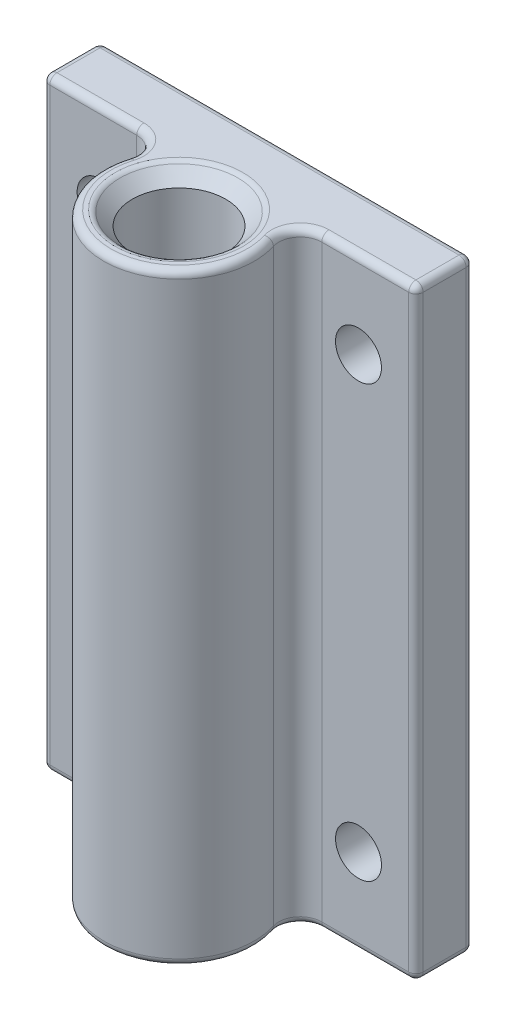
from build123d import *

# Parameters (mm, degrees)
SKETCH_1_W      = 26
SKETCH_1_H      = 42
SKETCH_1_R      = 1.6
EXTRUDE_1_DEPTH = 4
SKETCH_3_R      = 5.25
SKETCH_3_R_2    = 3.25
EXTRUDE_2_DEPTH = 21
FILLET_1_R      = 1.5
CHAMFER_1_SIZE  = 1
FILLET_3_R      = 0.5


with BuildPart() as part:
    # 草图1 → 凸台-拉伸1 (new body)
    with BuildSketch(Plane.XY):
        Rectangle(SKETCH_1_W, SKETCH_1_H)
        with Locations((-9, 15)):
            Circle(SKETCH_1_R, mode=Mode.SUBTRACT)
        with Locations(Location((-9, -15, 0), (0, 0, 180))):
            Circle(SKETCH_1_R, mode=Mode.SUBTRACT)
        with Locations((9, -15)):
            Circle(SKETCH_1_R, mode=Mode.SUBTRACT)
        with Locations(Location((9, 15, 0), (0, 0, 180))):
            Circle(SKETCH_1_R, mode=Mode.SUBTRACT)
    extrude(amount=EXTRUDE_1_DEPTH)

    # 草图3 → 凸台-拉伸2 (add, symmetric)
    with BuildSketch(Plane(origin=(0, 0, 0), x_dir=(1, 0, 0), z_dir=(0, 1, 0))):
        with Locations((0, -7.5)):
            Circle(SKETCH_3_R)
        with Locations(Location((0, -7.5, 0), (0, 0, 90))):
            Circle(SKETCH_3_R_2, mode=Mode.SUBTRACT)
    extrude(amount=EXTRUDE_2_DEPTH, both=True)

    # 圆角1
    fillet_1_edges = [part.edges().sort_by_distance(p)[0] for p in [
        (-3.913118961, 0, 4),
        (3.913118961, 0, 4),
    ]]
    fillet(fillet_1_edges, radius=FILLET_1_R)

    # 倒角1
    chamfer_1_edges = [part.edges().sort_by_distance(p)[0] for p in [
        (0, -21, 10.75),
        (0, 21, 10.75),
    ]]
    chamfer(chamfer_1_edges, length=CHAMFER_1_SIZE)

    # 圆角3
    fillet_3_edges = [part.edges().sort_by_distance(p)[0] for p in [
        (13, 0, 4),
        (9.72344924, 21, 4),
        (9.72344924, -21, 4),
        (0, -21, 12.75),
        (0, 21, 12.75),
        (-9.72344924, 21, 4),
        (5.23928375, -21, 4.610243479),
        (5.23928375, 21, 4.610243479),
        (-13, 0, 4),
        (0, 21, 0),
        (-5.23928375, 21, 4.610243479),
        (-5.23928375, -21, 4.610243479),
        (13, 0, 0),
        (0, -21, 0),
        (0, -21, 11.75),
        (0, 21, 11.75),
        (-13, 0, 0),
        (-13, 21, 2),
        (13, 21, 2),
        (13, -21, 2),
        (-13, -21, 2),
        (-9.72344924, -21, 4),
    ]]
    fillet(fillet_3_edges, radius=FILLET_3_R)


solid = part.part
